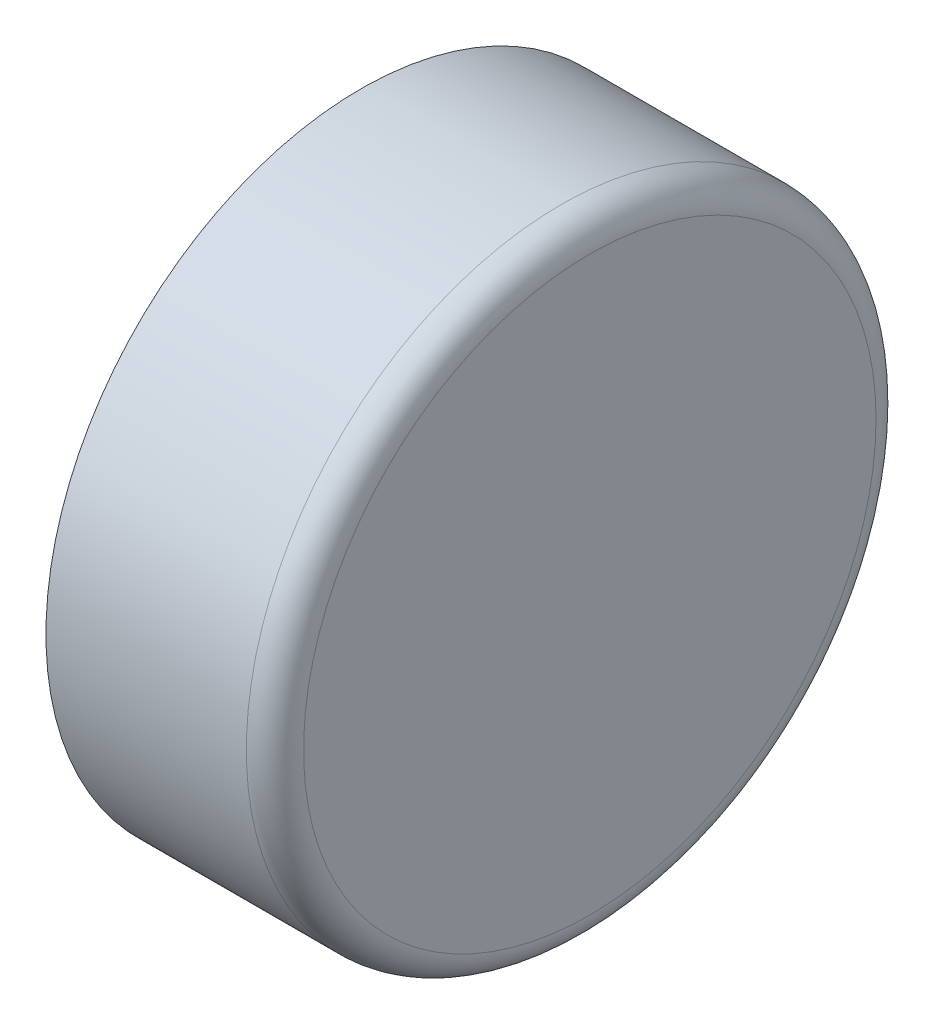
from build123d import *

# Parameters (mm, degrees)
SKETCH1_R           = 11
BOSS_EXTRUDE1_DEPTH = 8
SKETCH2_R           = 3
CUT_EXTRUDE1_DEPTH  = 7
FILLET1_R           = 1


with BuildPart() as part:
    # Sketch1 → Boss-Extrude1 (new body)
    with BuildSketch(Plane(origin=(0, 0, 0), x_dir=(0, 0, -1), z_dir=(1, 0, 0))):
        Circle(SKETCH1_R)
    extrude(amount=BOSS_EXTRUDE1_DEPTH)

    # Sketch2 → Cut-Extrude1 (cut)
    with BuildSketch(Plane.ZY):
        Circle(SKETCH2_R)
    extrude(amount=-CUT_EXTRUDE1_DEPTH, mode=Mode.SUBTRACT)

    # Fillet1
    fillet1_edges = [part.edges().sort_by_distance(p)[0] for p in [
        (8, 0, 11),
    ]]
    fillet(fillet1_edges, radius=FILLET1_R)


solid = part.part
